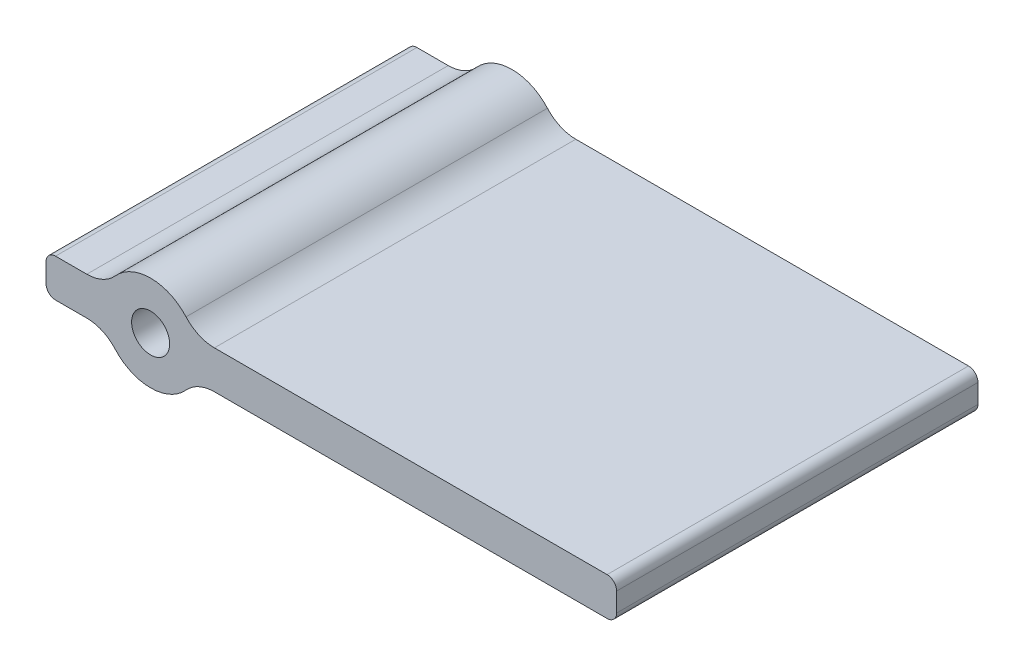
from build123d import *

# Parameters (mm, degrees)
BOSS_EXTRUDE1_DEPTH      = 9.5
BOSS_EXTRUDE1_DEPTH_BACK = 9.5
SKETCH1_R                = 1


with BuildPart() as part:
    # Sketch1 → Boss-Extrude1 (new, two sides: drawn at the far end of the back side and taken through both)
    with BuildSketch(Plane.XY.offset(-BOSS_EXTRUDE1_DEPTH_BACK)):
        with BuildLine():
            Line((-948.662974387, 303.387338025), (-947.017076353, 303.387338025))
            ThreePointArc((-947.017076353, 303.387338025), (-946.200579773, 303.213079884), (-945.526364368, 302.720671359))
            ThreePointArc((-945.526364368, 302.720671359), (-943.662974387, 301.887338025), (-941.799584406, 302.720671359))
            ThreePointArc((-941.799584406, 302.720671359), (-941.125369002, 303.213079884), (-940.308872421, 303.387338025))
            Line((-940.308872421, 303.387338025), (-919.662974387, 303.387338025))
            ThreePointArc((-919.662974387, 303.387338025), (-919.309420997, 303.533784635), (-919.162974387, 303.887338025))
            Line((-919.162974387, 303.887338025), (-919.162974387, 304.887338025))
            ThreePointArc((-919.162974387, 304.887338025), (-919.309420997, 305.240891416), (-919.662974387, 305.387338025))
            Line((-919.662974387, 305.387338025), (-940.308872421, 305.387338025))
            ThreePointArc((-940.308872421, 305.387338025), (-941.125369002, 305.561596167), (-941.799584406, 306.054004692))
            ThreePointArc((-941.799584406, 306.054004692), (-943.662974387, 306.887338025), (-945.526364368, 306.054004692))
            ThreePointArc((-945.526364368, 306.054004692), (-946.200579773, 305.561596167), (-947.017076353, 305.387338025))
            Line((-947.017076353, 305.387338025), (-948.662974387, 305.387338025))
            ThreePointArc((-948.662974387, 305.387338025), (-949.016527778, 305.240891416), (-949.162974387, 304.887338025))
            Line((-949.162974387, 304.887338025), (-949.162974387, 303.887338025))
            ThreePointArc((-949.162974387, 303.887338025), (-949.016527778, 303.533784635), (-948.662974387, 303.387338025))
        make_face()
        with Locations((-943.662974387, 304.387338025)):
            Circle(SKETCH1_R, mode=Mode.SUBTRACT)
    extrude(amount=BOSS_EXTRUDE1_DEPTH + BOSS_EXTRUDE1_DEPTH_BACK)


solid = part.part
